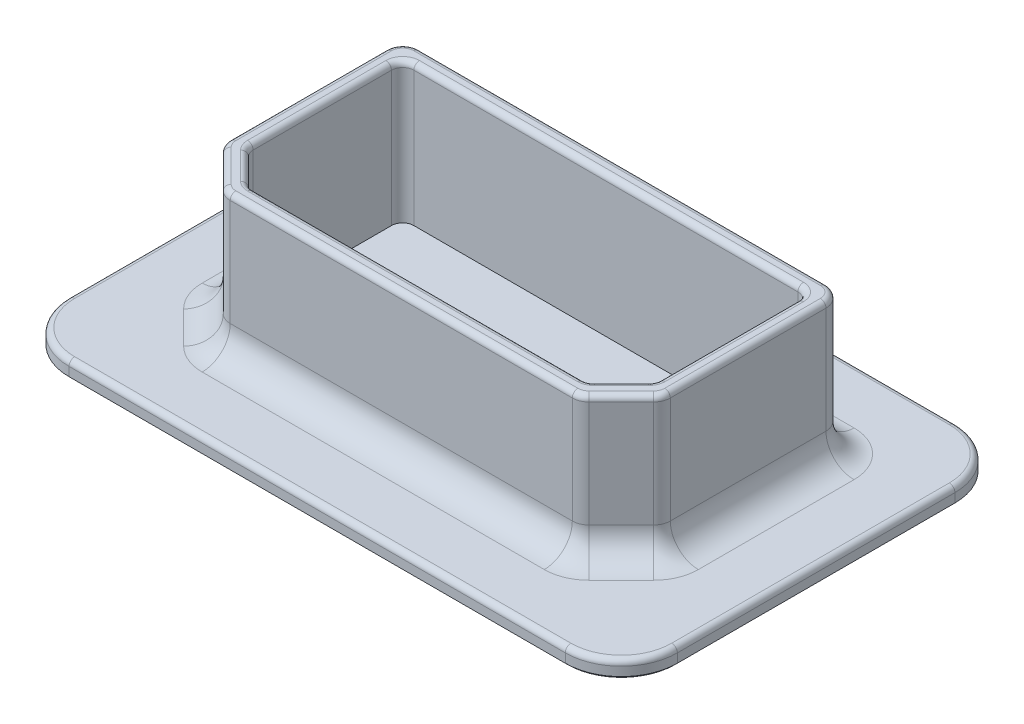
from build123d import *

# Parameters (mm, degrees)
SKETCH_1_W      = 78.5
SKETCH_1_H      = 39.5
SKETCH_1_W_2    = 72.5
SKETCH_1_H_2    = 33.5
EXTRUDE_1_DEPTH = 25
SKETCH_2_W      = 108.5
SKETCH_2_H      = 69.5
EXTRUDE_2_DEPTH = 3
FILLET_1_R      = 10
CHAMFER_1_SIZE  = 6
CHAMFER_2_SIZE  = 7.5
FILLET_2_R      = 2
FILLET_3_R      = 3
FILLET_4_R      = 5
FILLET_5_R      = 1
FILLET_6_R      = 1
CHAMFER_3_SIZE  = 0.4


with BuildPart() as part:
    # 草图1 → 凸台-拉伸1 (new body)
    with BuildSketch(Plane(origin=(0, 0, 0), x_dir=(1, 0, 0), z_dir=(0, 1, 0))):
        with Locations((36.25, 16.75)):
            Rectangle(SKETCH_1_W, SKETCH_1_H)
        with Locations((36.25, 16.75)):
            Rectangle(SKETCH_1_W_2, SKETCH_1_H_2, mode=Mode.SUBTRACT)
    extrude(amount=EXTRUDE_1_DEPTH)

    # 草图2 → 凸台-拉伸2 (add)
    with BuildSketch(Plane(origin=(0, 0, 0), x_dir=(-1, 0, 0), z_dir=(0, -1, 0))):
        with Locations((-36.25, 16.75)):
            Rectangle(SKETCH_2_W, SKETCH_2_H)
    extrude(amount=EXTRUDE_2_DEPTH)

    # 圆角1
    fillet_1_edges = [part.edges().sort_by_distance(p)[0] for p in [
        (-18, -1.5, -51.5),
        (90.5, -1.5, -51.5),
        (90.5, -1.5, 18),
        (-18, -1.5, 18),
    ]]
    fillet(fillet_1_edges, radius=FILLET_1_R)

    # 倒角1
    chamfer_1_edges = [part.edges().sort_by_distance(p)[0] for p in [
        (0, 12.5, 0),
        (72.5, 12.5, 0),
    ]]
    chamfer(chamfer_1_edges, length=CHAMFER_1_SIZE)

    # 倒角2
    chamfer_2_edges = [part.edges().sort_by_distance(p)[0] for p in [
        (75.5, 12.5, 3),
        (-3, 12.5, 3),
    ]]
    chamfer(chamfer_2_edges, length=CHAMFER_2_SIZE)

    # 圆角2
    fillet_2_edges = [part.edges().sort_by_distance(p)[0] for p in [
        (0, 12.5, -33.5),
        (72.5, 12.5, -33.5),
        (6, 12.5, 0),
        (66.5, 12.5, 0),
        (72.5, 12.5, -6),
        (0, 12.5, -6),
    ]]
    fillet(fillet_2_edges, radius=FILLET_2_R)

    # 圆角3
    fillet_3_edges = [part.edges().sort_by_distance(p)[0] for p in [
        (-3, 12.5, -36.5),
        (75.5, 12.5, -36.5),
        (68, 12.5, 3),
        (4.5, 12.5, 3),
        (-3, 12.5, -4.5),
        (75.5, 12.5, -4.5),
    ]]
    fillet(fillet_3_edges, radius=FILLET_3_R)

    # 圆角4
    fillet_4_edges = [part.edges().sort_by_distance(p)[0] for p in [
        (75.5, 0, -19.621320344),
        (71.75, 0, -0.75),
        (36.25, 0, 3),
        (0.75, 0, -0.75),
        (-3, 0, -19.621320344),
        (36.25, 0, -36.5),
        (75.271638598, 0, -4.59459039),
        (67.90540961, 0, 2.771638598),
        (4.59459039, 0, 2.771638598),
        (-2.771638598, 0, -4.59459039),
        (-2.121320344, 0, -35.621320344),
        (74.621320344, 0, -35.621320344),
    ]]
    fillet(fillet_4_edges, radius=FILLET_4_R)

    # 圆角5
    fillet_5_edges = [part.edges().sort_by_distance(p)[0] for p in [
        (0, 25, -19.164213562),
        (72.5, 25, -19.164213562),
        (69.5, 25, -3),
        (3, 25, -3),
        (36.25, 25, 0),
        (0.585786438, 25, -32.914213562),
        (71.914213562, 25, -32.914213562),
        (72.347759065, 25, -6.06306026),
        (0.152240935, 25, -6.06306026),
        (6.06306026, 25, -0.152240935),
        (66.43693974, 25, -0.152240935),
        (75.5, 25, -19.621320344),
        (71.75, 25, -0.75),
        (-3, 25, -19.621320344),
        (0.75, 25, -0.75),
        (36.25, 25, 3),
        (36.25, 25, -36.5),
        (74.621320344, 25, -35.621320344),
        (-2.121320344, 25, -35.621320344),
        (-2.771638598, 25, -4.59459039),
        (4.59459039, 25, 2.771638598),
        (67.90540961, 25, 2.771638598),
        (75.271638598, 25, -4.59459039),
        (36.25, 25, -33.5),
    ]]
    fillet(fillet_5_edges, radius=FILLET_5_R)

    # 圆角6
    fillet_6_edges = [part.edges().sort_by_distance(p)[0] for p in [
        (-18, 0, -16.75),
        (36.25, 0, -51.5),
        (36.25, 0, 18),
        (90.5, 0, -16.75),
        (87.571067812, 0, 15.071067812),
        (87.571067812, 0, -48.571067812),
        (-15.071067812, 0, -48.571067812),
        (-15.071067812, 0, 15.071067812),
    ]]
    fillet(fillet_6_edges, radius=FILLET_6_R)

    # 倒角3
    chamfer_3_edges = [part.edges().sort_by_distance(p)[0] for p in [
        (-18, -3, -16.75),
        (36.25, -3, 18),
        (36.25, -3, -51.5),
        (90.5, -3, -16.75),
        (87.571067812, -3, 15.071067812),
        (87.571067812, -3, -48.571067812),
        (-15.071067812, -3, -48.571067812),
        (-15.071067812, -3, 15.071067812),
    ]]
    chamfer(chamfer_3_edges, length=CHAMFER_3_SIZE)


solid = part.part
